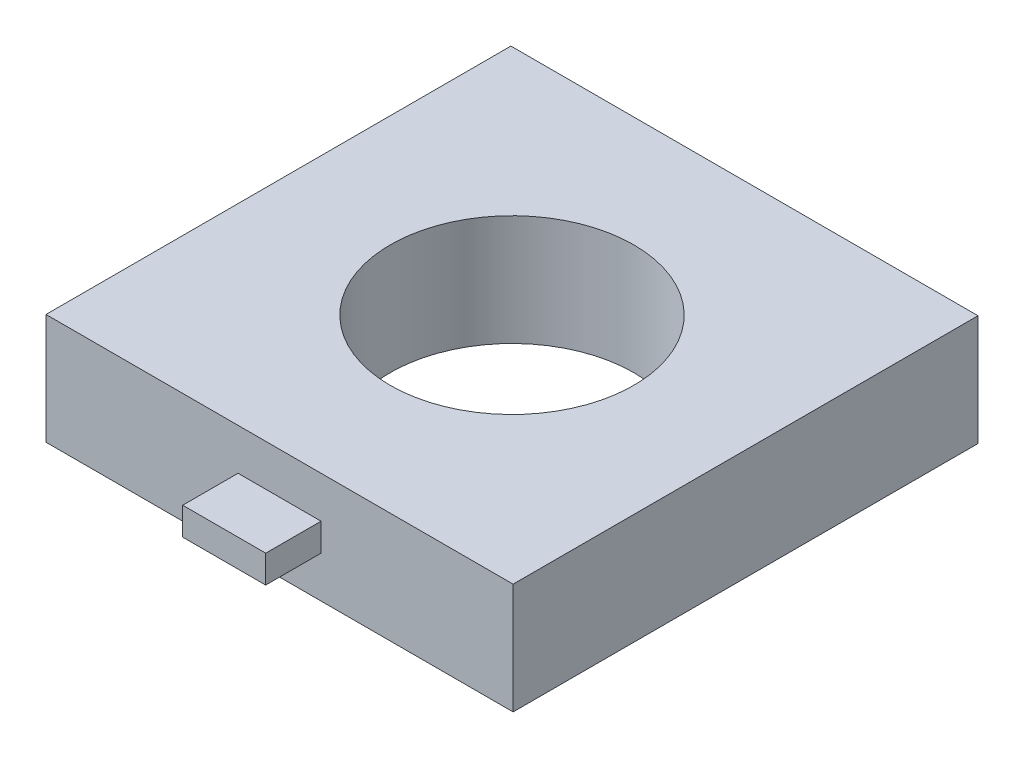
from build123d import *

# Parameters (mm, degrees)
CROQUIS1_W              = 42.2
CROQUIS1_H              = 10
SALIENTE_EXTRUIR1_DEPTH = 42
CROQUIS2_W              = 7.5
CROQUIS2_H              = 2.5
SALIENTE_EXTRUIR2_DEPTH = 5
CROQUIS3_R              = 11
CORTAR_EXTRUIR1_DEPTH   = 25


with BuildPart() as part:
    # Croquis1 → Saliente-Extruir1 (new body)
    with BuildSketch(Plane.XY):
        with Locations((21.1, -5)):
            Rectangle(CROQUIS1_W, CROQUIS1_H)
    extrude(amount=SALIENTE_EXTRUIR1_DEPTH)

    # Croquis2 → Saliente-Extruir2 (add)
    with BuildSketch(Plane.XY.offset(42)):
        with Locations((21.1, -5)):
            Rectangle(CROQUIS2_W, CROQUIS2_H)
    extrude(amount=SALIENTE_EXTRUIR2_DEPTH)

    # Croquis3 → Cortar-Extruir1 (cut)
    with BuildSketch(Plane(origin=(0, 0, 0), x_dir=(1, 0, 0), z_dir=(0, 1, 0))):
        with Locations(Location((21.1, -21, 0), (0, 0, 270))):
            Circle(CROQUIS3_R)
    extrude(amount=-CORTAR_EXTRUIR1_DEPTH, mode=Mode.SUBTRACT)


solid = part.part
